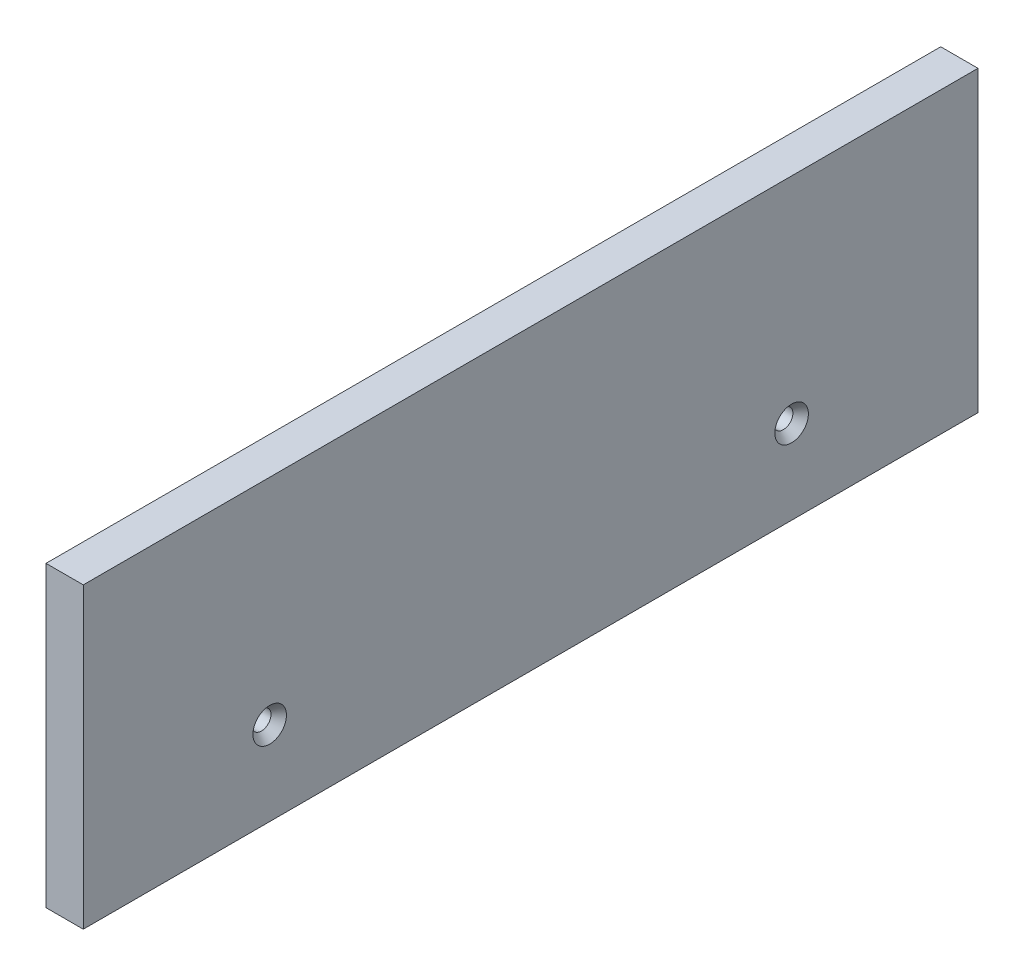
from build123d import *

# Parameters (mm, degrees)
SKETCH1_W                                      = 152.4
SKETCH1_H                                      = 50.8
BOSS_EXTRUDE1_DEPTH                            = 6.35
CSK_FOR_4_FLAT_HEAD_MACHINE_SCREW1_D           = 3.2639
CSK_FOR_4_FLAT_HEAD_MACHINE_SCREW1_CSINK_D     = 5.715
CSK_FOR_4_FLAT_HEAD_MACHINE_SCREW1_CSINK_ANGLE = 82


with BuildPart() as part:
    # Sketch1 → Boss-Extrude1 (new body)
    with BuildSketch(Plane(origin=(0, 0, 0), x_dir=(0, 0, -1), z_dir=(1, 0, 0))):
        with Locations((76.2, 25.4)):
            Rectangle(SKETCH1_W, SKETCH1_H)
    extrude(amount=BOSS_EXTRUDE1_DEPTH)

    # CSK for #4 Flat Head Machine Screw1 (through all)
    with Locations(Plane(origin=(6.35, 0, 0), x_dir=(0, 0, -1), z_dir=(1, 0, 0))):
        with Locations((31.75, 14.2875), (120.65, 14.2875)):
            CounterSinkHole(CSK_FOR_4_FLAT_HEAD_MACHINE_SCREW1_D / 2, CSK_FOR_4_FLAT_HEAD_MACHINE_SCREW1_CSINK_D / 2, counter_sink_angle=CSK_FOR_4_FLAT_HEAD_MACHINE_SCREW1_CSINK_ANGLE)


solid = part.part
